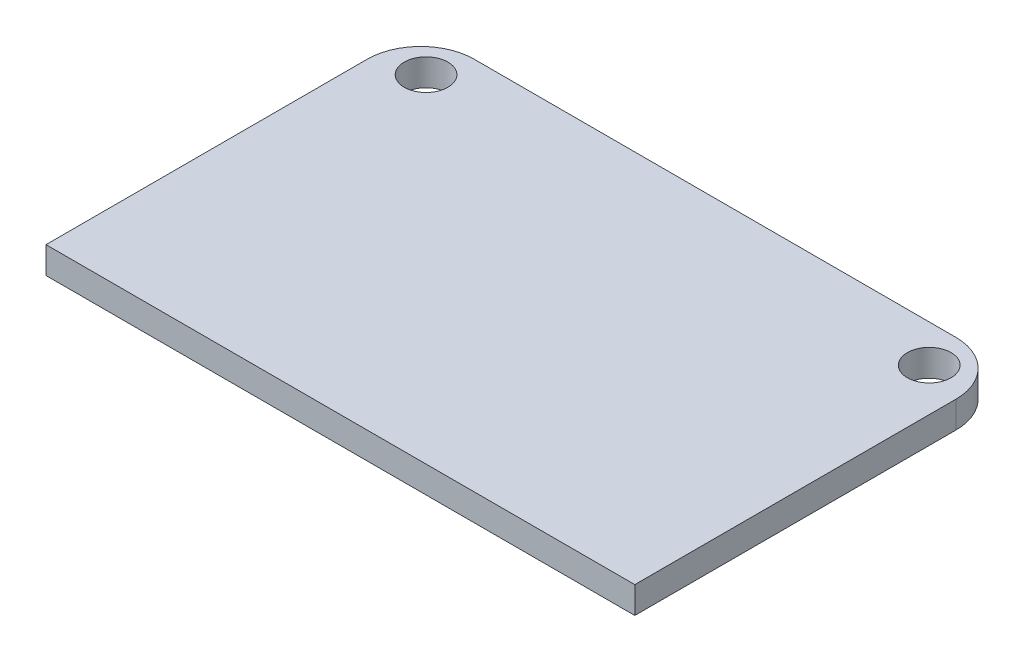
from build123d import *

# Parameters (mm, degrees)
SKETCH1_W                      = 69.85
SKETCH1_H                      = 44.45
BOSS_EXTRUDE1_DEPTH            = 3.175
FILLET1_R                      = 6.35
F_6_0_204_DIAMETER_HOLE1_D     = 5.1816
F_6_0_204_DIAMETER_HOLE1_DEPTH = 38.1
F_6_0_204_DIAMETER_HOLE1_TIP   = 1.556709692


with BuildPart() as part:
    # Sketch1 → Boss-Extrude1 (new body)
    with BuildSketch(Plane(origin=(0, 0, 0), x_dir=(1, 0, 0), z_dir=(0, 1, 0))):
        Rectangle(SKETCH1_W, SKETCH1_H)
    extrude(amount=BOSS_EXTRUDE1_DEPTH)

    # Fillet1
    fillet1_edges = [part.edges().sort_by_distance(p)[0] for p in [
        (-34.925, 1.5875, -22.225),
        (34.925, 1.5875, -22.225),
    ]]
    fillet(fillet1_edges, radius=FILLET1_R)

    # #6 (0.204) Diameter Hole1
    with Locations(Plane(origin=(0, 0, 0), x_dir=(-1, 0, 0), z_dir=(0, -1, 0))):
        with Locations((-29.845, 17.78), (29.845, 17.78)):
            Hole(F_6_0_204_DIAMETER_HOLE1_D / 2, depth=F_6_0_204_DIAMETER_HOLE1_DEPTH)
            with Locations((0, 0, -(F_6_0_204_DIAMETER_HOLE1_DEPTH + F_6_0_204_DIAMETER_HOLE1_TIP / 2))):  # 118° drill point
                Cone(0, F_6_0_204_DIAMETER_HOLE1_D / 2, F_6_0_204_DIAMETER_HOLE1_TIP, mode=Mode.SUBTRACT)


solid = part.part
